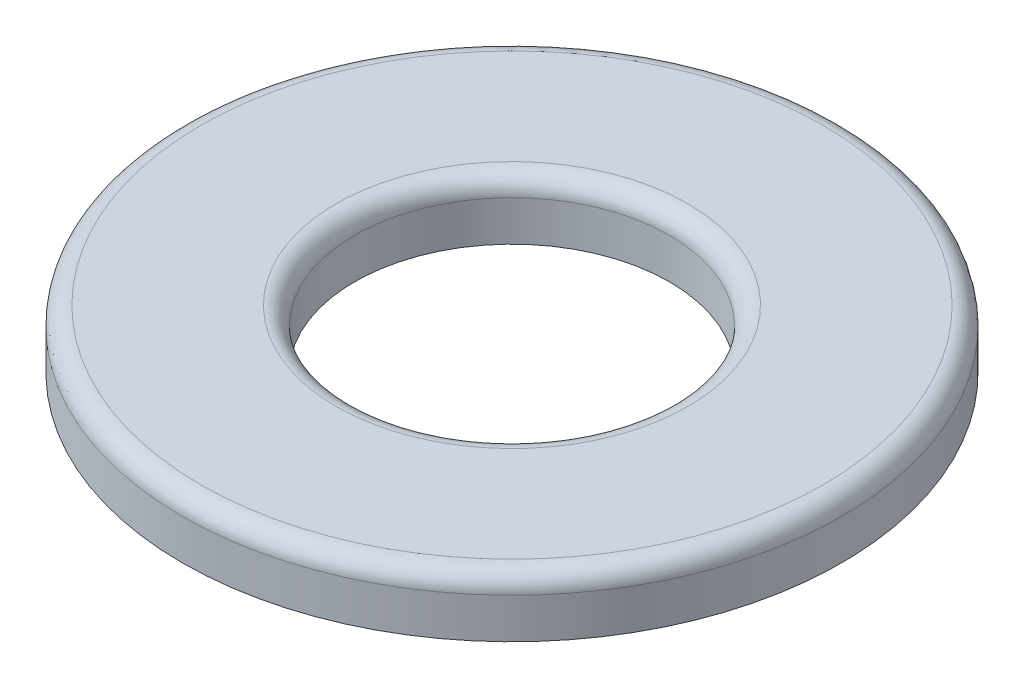
from build123d import *

# Parameters (mm, degrees)
SZKIC1_R                    = 4.5
SZKIC1_R_2                  = 2.15
DODANIE_WYCI_GNI_CIE1_DEPTH = 0.8
ZAOKR_GLENIE1_R             = 0.25


with BuildPart() as part:
    # Szkic1 → Dodanie-wyciągnięcie1 (new body)
    with BuildSketch(Plane(origin=(0, 0, 0), x_dir=(1, 0, 0), z_dir=(0, 1, 0))):
        with Locations(Location((0, 0, 0), (0, 0, 270))):
            Circle(SZKIC1_R)
        with Locations(Location((0, 0, 0), (0, 0, 270))):
            Circle(SZKIC1_R_2, mode=Mode.SUBTRACT)
    extrude(amount=DODANIE_WYCI_GNI_CIE1_DEPTH)

    # Zaokrąglenie1
    zaokr_glenie1_edges = [part.edges().sort_by_distance(p)[0] for p in [
        (0, 0.8, -4.5),
        (0, 0.8, -2.15),
    ]]
    fillet(zaokr_glenie1_edges, radius=ZAOKR_GLENIE1_R)


solid = part.part
